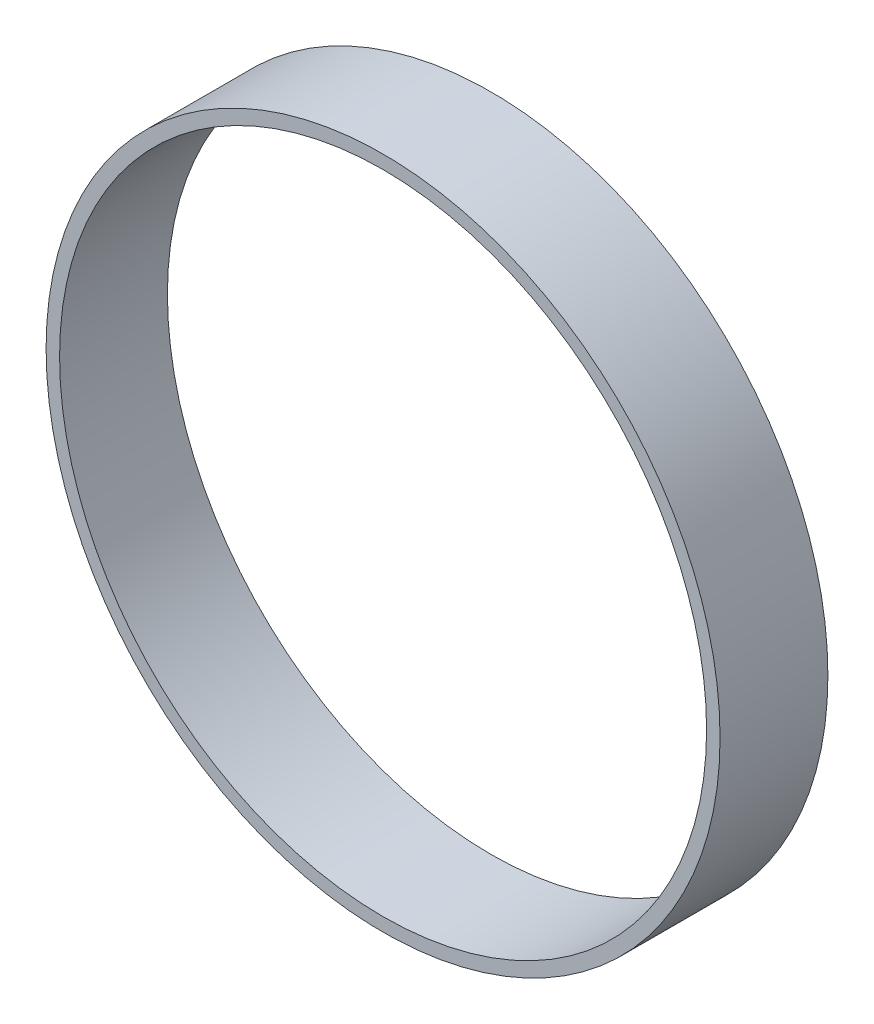
from build123d import *

# Parameters (mm, degrees)
SKETCH1_W = 50.8
SKETCH1_H = 6.35


with BuildPart() as part:
    # Sketch1 → Revolve1 (revolve)
    with BuildSketch(Plane(origin=(0, 0, 0), x_dir=(0, 0, -1), z_dir=(1, 0, 0)), mode=Mode.PRIVATE) as revolve1_sk:
        with Locations((-63.5, 155.575)):
            Rectangle(SKETCH1_W, SKETCH1_H)
    revolve(revolve1_sk.sketch.rotate(Axis((0, 0, 12.590517241), (0, 0, 1)), 90), axis=Axis((0, 0, 12.590517241), (0, 0, 1)))


solid = part.part
